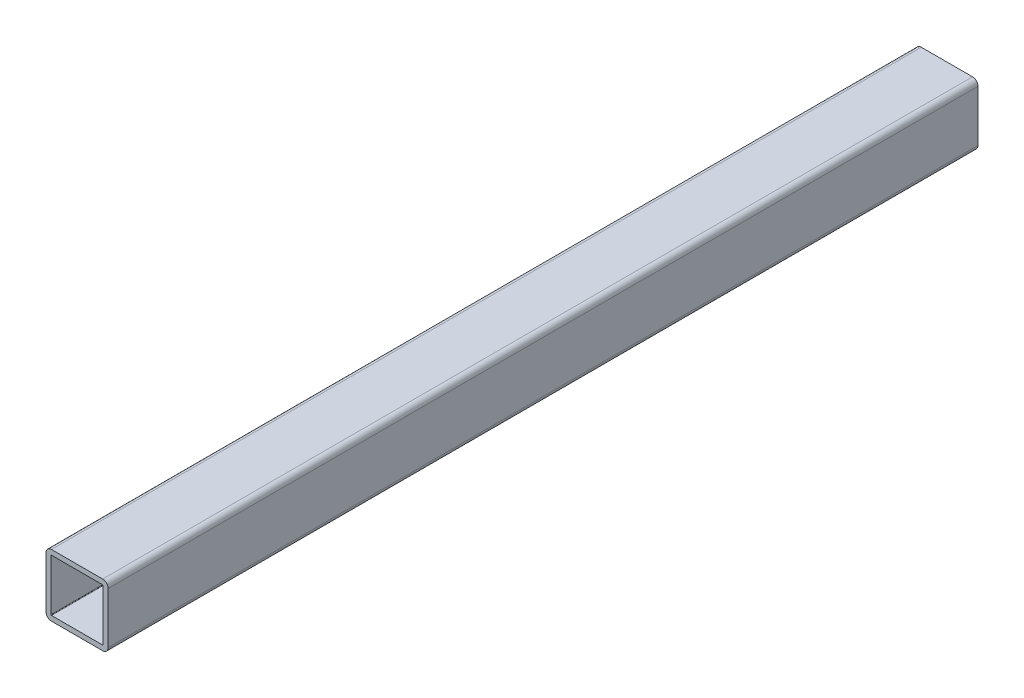
from build123d import *

# Parameters (mm, degrees)
STRUCTURAL_MEMBER1_DEPTH = 350


with BuildPart() as part:
    # Sketch11 → Structural Member1 (new body)
    with BuildSketch(Plane(origin=(0, 0, 0), x_dir=(-1, 0, 0), z_dir=(0, 0, -1))):
        with BuildLine():
            Line((-10.3, -12.5), (10.3, -12.5))
            ThreePointArc((10.3, -12.5), (11.855634919, -11.855634919), (12.5, -10.3))
            Line((12.5, -10.3), (12.5, 10.3))
            ThreePointArc((12.5, 10.3), (11.855634919, 11.855634919), (10.3, 12.5))
            Line((10.3, 12.5), (-10.3, 12.5))
            ThreePointArc((-10.3, 12.5), (-11.855634919, 11.855634919), (-12.5, 10.3))
            Line((-12.5, 10.3), (-12.5, -10.3))
            ThreePointArc((-12.5, -10.3), (-11.855634919, -11.855634919), (-10.3, -12.5))
        make_face()
        with BuildLine():
            Line((-10.3, -10.5), (10.3, -10.5))
            ThreePointArc((10.3, -10.5), (10.441421356, -10.441421356), (10.5, -10.3))
            Line((10.5, -10.3), (10.5, 10.3))
            ThreePointArc((10.5, 10.3), (10.441421356, 10.441421356), (10.3, 10.5))
            Line((10.3, 10.5), (-10.3, 10.5))
            ThreePointArc((-10.3, 10.5), (-10.441421356, 10.441421356), (-10.5, 10.3))
            Line((-10.5, 10.3), (-10.5, -10.3))
            ThreePointArc((-10.5, -10.3), (-10.441421356, -10.441421356), (-10.3, -10.5))
        make_face(mode=Mode.SUBTRACT)
    extrude(amount=STRUCTURAL_MEMBER1_DEPTH)


solid = part.part
